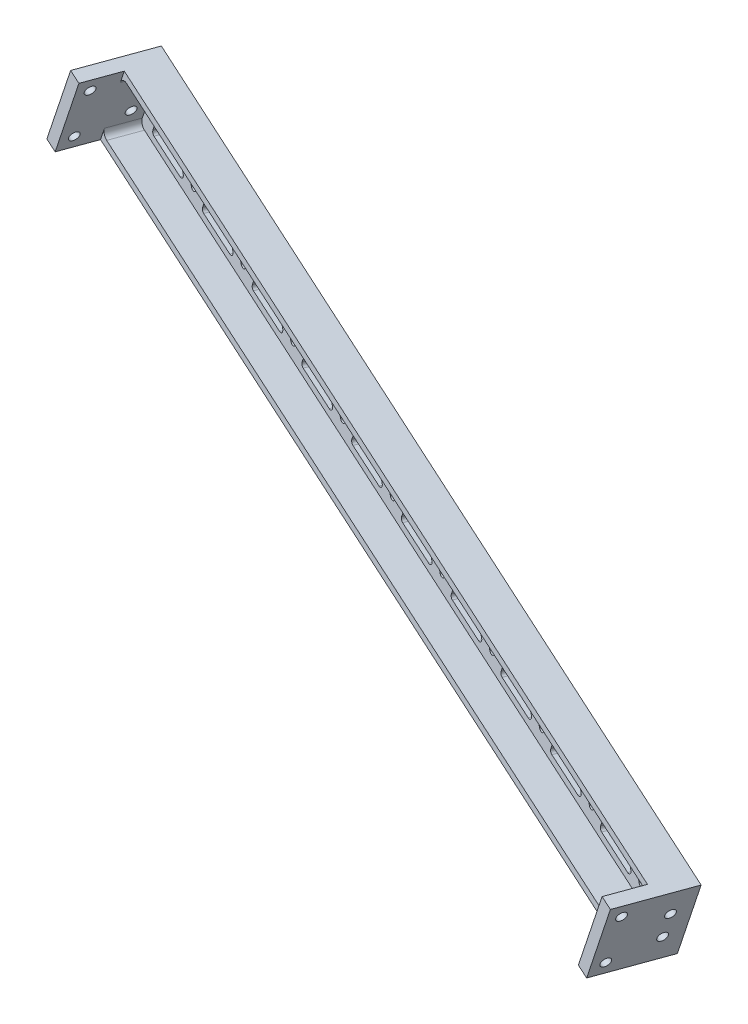
from build123d import *

# Parameters (mm, degrees)
SKETCH2_W                  = 38.1
SKETCH2_H                  = 38.1
BOSS_EXTRUDE1_DEPTH        = 6.35
BOSS_EXTRUDE2_DEPTH        = 407.126124618
SKETCH4_W                  = 38.1
SKETCH4_H                  = 38.1
BOSS_EXTRUDE3_DEPTH        = 6.35
FILLET1_R                  = 3.175
F_10_32_TAPPED_HOLE1_D     = 4.826
F_10_32_TAPPED_HOLE1_DEPTH = 6.35
F_10_32_TAPPED_HOLE2_D     = 4.826
CUT_EXTRUDE1_REACH         = 478.898


with BuildPart() as part:
    # Sketch2 → Boss-Extrude1 (new body)
    with BuildSketch(Plane(origin=(38.365770367, -12.788590122, 10.657158435), x_dir=(0.2417468892076139, -0.08058229640253844, -0.9669875568304563), z_dir=(0.917364944587726, -0.30578831486257557, 0.25482359571881275))):
        Rectangle(SKETCH2_W, SKETCH2_H)
    extrude(amount=BOSS_EXTRUDE1_DEPTH)

    # Sketch3 → Boss-Extrude2 (add)
    with BuildSketch(Plane(origin=(44.191037765, -14.730345922, 12.275288268), x_dir=(0.24174688920761397, -0.0805822964025384, -0.9669875568304563), z_dir=(0.917364944587726, -0.30578831486257557, 0.2548235957188128))):
        Polygon((0, 19.05), (0, 15.875), (15.875, 15.875), (15.875, -15.875), (0, -15.875), (0, -19.05), (19.05, -19.05), (19.05, 19.05), align=None)
    extrude(amount=BOSS_EXTRUDE2_DEPTH)

    # Sketch4 → Boss-Extrude3 (add)
    with BuildSketch(Plane(origin=(417.674272515, -139.224757505, 116.020631254), x_dir=(0.24174688920761386, -0.08058229640253753, -0.9669875568304566), z_dir=(0.9173649445877263, -0.30578831486257485, 0.2548235957188124))):
        Rectangle(SKETCH4_W, SKETCH4_H)
    extrude(amount=-BOSS_EXTRUDE3_DEPTH)

    # Fillet1
    fillet1_edges = [part.edges().sort_by_distance(p)[0] for p in [
        (41.089787913, -30.430315256, 4.599824536),
        (51.130019484, -0.309620543, 4.599824536),
        (408.747755265, -152.98297104, 106.727037689),
        (418.787986836, -122.862276327, 106.727037689),
    ]]
    fillet(fillet1_edges, radius=FILLET1_R)

    # #10-32 Tapped Hole1
    with Locations(Plane(origin=(38.365770367, -12.788590122, 10.657158435), x_dir=(-0.24174688920761406, 0.08058229640253843, 0.9669875568304563), z_dir=(-0.917364944587726, 0.3057883148625754, -0.25482359571881286))):
        with Locations((12.7, 12.7), (12.7, -12.7), (-9.525, -6.35), (-9.525, 6.35)):
            Hole(F_10_32_TAPPED_HOLE1_D / 2, depth=F_10_32_TAPPED_HOLE1_DEPTH)

    # #10-32 Tapped Hole2 (through all)
    with Locations(Plane(origin=(417.674272515, -139.224757505, 116.020631254), x_dir=(0.24174688920761347, -0.08058229640253826, -0.9669875568304566), z_dir=(0.9173649445877262, -0.30578831486257485, 0.25482359571881225))):
        with Locations((-12.7, 12.7), (-12.7, -12.7), (9.525, 6.35), (9.525, -6.35)):
            Hole(F_10_32_TAPPED_HOLE2_D / 2)

    # Sketch11 → Cut-Extrude1 (cut, up to next)
    with BuildSketch(Plane(origin=(3.837731866, -1.279243955, -15.350927465), x_dir=(0.9703393435074359, 0.02007598641739537, 0.24091183700874258), z_dir=(-0.24174688920761397, 0.08058229640253822, 0.9669875568304563)), mode=Mode.PRIVATE) as cut_extrude1_sk1:
        with BuildLine():
            Line((55.395545665, -9.716076146), (48.884204495, -28.605233817))
            ThreePointArc((48.884204495, -28.605233817), (48.957961721, -29.818012949), (49.867680304, -30.623423063))
            Line((49.867680304, -30.623423063), (68.756837975, -37.134764234))
            ThreePointArc((68.756837975, -37.134764234), (70.462799302, -36.686250733), (70.701269995, -34.938509292))
            Line((70.701269995, -34.938509292), (58.323453495, -9.538010451))
            ThreePointArc((58.323453495, -9.538010451), (56.800009733, -8.648860566), (55.395545665, -9.716076146))
        make_face()
    cut_extrude1_tool1 = extrude(cut_extrude1_sk1.sketch, amount=-CUT_EXTRUDE1_REACH, mode=Mode.PRIVATE) & part.part
    # Sketch11 → Cut-Extrude1 (cut, up to next)
    with BuildSketch(Plane(origin=(3.837731866, -1.279243955, -15.350927465), x_dir=(0.9703393435074359, 0.02007598641739537, 0.24091183700874258), z_dir=(-0.24174688920761397, 0.08058229640253822, 0.9669875568304563)), mode=Mode.PRIVATE) as cut_extrude1_sk2:
        with BuildLine():
            Line((79.632507934, -36.829870471), (86.143849105, -17.9407128))
            ThreePointArc((86.143849105, -17.9407128), (86.070091879, -16.727933668), (85.160373296, -15.922523554))
            Line((85.160373296, -15.922523554), (66.271215625, -9.411182383))
            ThreePointArc((66.271215625, -9.411182383), (64.565254297, -9.859695885), (64.326783605, -11.607437325))
            Line((64.326783605, -11.607437325), (76.704600105, -37.007936166))
            ThreePointArc((76.704600105, -37.007936166), (78.228043867, -37.897086051), (79.632507934, -36.829870471))
        make_face()
    cut_extrude1_tool2 = extrude(cut_extrude1_sk2.sketch, amount=-CUT_EXTRUDE1_REACH, mode=Mode.PRIVATE) & part.part
    # Sketch11 → Cut-Extrude1 (cut, up to next)
    with BuildSketch(Plane(origin=(3.837731866, -1.279243955, -15.350927465), x_dir=(0.9703393435074359, 0.02007598641739537, 0.24091183700874258), z_dir=(-0.24174688920761397, 0.08058229640253822, 0.9669875568304563)), mode=Mode.PRIVATE) as cut_extrude1_sk3:
        with BuildLine():
            Line((91.415526327, -22.132637389), (84.904185157, -41.02179506))
            ThreePointArc((84.904185157, -41.02179506), (84.977942383, -42.234574192), (85.887660966, -43.039984306))
            Line((85.887660966, -43.039984306), (104.776818637, -49.551325477))
            ThreePointArc((104.776818637, -49.551325477), (106.482779964, -49.102811976), (106.721250657, -47.355070536))
            Line((106.721250657, -47.355070536), (94.343434157, -21.954571694))
            ThreePointArc((94.343434157, -21.954571694), (92.819990395, -21.065421809), (91.415526327, -22.132637389))
        make_face()
    cut_extrude1_tool3 = extrude(cut_extrude1_sk3.sketch, amount=-CUT_EXTRUDE1_REACH, mode=Mode.PRIVATE) & part.part
    # Sketch11 → Cut-Extrude1 (cut, up to next)
    with BuildSketch(Plane(origin=(3.837731866, -1.279243955, -15.350927465), x_dir=(0.9703393435074359, 0.02007598641739537, 0.24091183700874258), z_dir=(-0.24174688920761397, 0.08058229640253822, 0.9669875568304563)), mode=Mode.PRIVATE) as cut_extrude1_sk4:
        with BuildLine():
            Line((115.652488596, -49.246431714), (122.163829767, -30.357274043))
            ThreePointArc((122.163829767, -30.357274043), (122.090072541, -29.144494911), (121.180353958, -28.339084797))
            Line((121.180353958, -28.339084797), (102.291196287, -21.827743627))
            ThreePointArc((102.291196287, -21.827743627), (100.585234959, -22.276257128), (100.346764267, -24.023998568))
            Line((100.346764267, -24.023998568), (112.724580767, -49.424497409))
            ThreePointArc((112.724580767, -49.424497409), (114.248024529, -50.313647294), (115.652488596, -49.246431714))
        make_face()
    cut_extrude1_tool4 = extrude(cut_extrude1_sk4.sketch, amount=-CUT_EXTRUDE1_REACH, mode=Mode.PRIVATE) & part.part
    # Sketch11 → Cut-Extrude1 (cut, up to next)
    with BuildSketch(Plane(origin=(3.837731866, -1.279243955, -15.350927465), x_dir=(0.9703393435074359, 0.02007598641739537, 0.24091183700874258), z_dir=(-0.24174688920761397, 0.08058229640253822, 0.9669875568304563)), mode=Mode.PRIVATE) as cut_extrude1_sk5:
        with BuildLine():
            Line((127.435506989, -34.549198632), (120.924165819, -53.438356303))
            ThreePointArc((120.924165819, -53.438356303), (120.997923045, -54.651135436), (121.907641628, -55.456545549))
            Line((121.907641628, -55.456545549), (140.796799299, -61.96788672))
            ThreePointArc((140.796799299, -61.96788672), (142.502760626, -61.519373219), (142.741231319, -59.771631779))
            Line((142.741231319, -59.771631779), (130.363414819, -34.371132937))
            ThreePointArc((130.363414819, -34.371132937), (128.839971057, -33.481983052), (127.435506989, -34.549198632))
        make_face()
    cut_extrude1_tool5 = extrude(cut_extrude1_sk5.sketch, amount=-CUT_EXTRUDE1_REACH, mode=Mode.PRIVATE) & part.part
    # Sketch11 → Cut-Extrude1 (cut, up to next)
    with BuildSketch(Plane(origin=(3.837731866, -1.279243955, -15.350927465), x_dir=(0.9703393435074359, 0.02007598641739537, 0.24091183700874258), z_dir=(-0.24174688920761397, 0.08058229640253822, 0.9669875568304563)), mode=Mode.PRIVATE) as cut_extrude1_sk6:
        with BuildLine():
            Line((151.672469258, -61.662992957), (158.183810429, -42.773835286))
            ThreePointArc((158.183810429, -42.773835286), (158.110053203, -41.561056154), (157.20033462, -40.75564604))
            Line((157.20033462, -40.75564604), (138.311176949, -34.24430487))
            ThreePointArc((138.311176949, -34.24430487), (136.605215621, -34.692818371), (136.366744929, -36.440559811))
            Line((136.366744929, -36.440559811), (148.744561429, -61.841058653))
            ThreePointArc((148.744561429, -61.841058653), (150.268005191, -62.730208537), (151.672469258, -61.662992957))
        make_face()
    cut_extrude1_tool6 = extrude(cut_extrude1_sk6.sketch, amount=-CUT_EXTRUDE1_REACH, mode=Mode.PRIVATE) & part.part
    # Sketch11 → Cut-Extrude1 (cut, up to next)
    with BuildSketch(Plane(origin=(3.837731866, -1.279243955, -15.350927465), x_dir=(0.9703393435074359, 0.02007598641739537, 0.24091183700874258), z_dir=(-0.24174688920761397, 0.08058229640253822, 0.9669875568304563)), mode=Mode.PRIVATE) as cut_extrude1_sk7:
        with BuildLine():
            Line((163.455487652, -46.965759876), (156.944146481, -65.854917546))
            ThreePointArc((156.944146481, -65.854917546), (157.017903707, -67.067696679), (157.92762229, -67.873106792))
            Line((157.92762229, -67.873106792), (176.816779961, -74.384447963))
            ThreePointArc((176.816779961, -74.384447963), (178.522741289, -73.935934462), (178.761211981, -72.188193022))
            Line((178.761211981, -72.188193022), (166.383395481, -46.78769418))
            ThreePointArc((166.383395481, -46.78769418), (164.859951719, -45.898544295), (163.455487652, -46.965759876))
        make_face()
    cut_extrude1_tool7 = extrude(cut_extrude1_sk7.sketch, amount=-CUT_EXTRUDE1_REACH, mode=Mode.PRIVATE) & part.part
    # Sketch11 → Cut-Extrude1 (cut, up to next)
    with BuildSketch(Plane(origin=(3.837731866, -1.279243955, -15.350927465), x_dir=(0.9703393435074359, 0.02007598641739537, 0.24091183700874258), z_dir=(-0.24174688920761397, 0.08058229640253822, 0.9669875568304563)), mode=Mode.PRIVATE) as cut_extrude1_sk8:
        with BuildLine():
            Line((187.69244992, -74.0795542), (194.203791091, -55.190396529))
            ThreePointArc((194.203791091, -55.190396529), (194.130033865, -53.977617397), (193.220315282, -53.172207283))
            Line((193.220315282, -53.172207283), (174.331157611, -46.660866113))
            ThreePointArc((174.331157611, -46.660866113), (172.625196284, -47.109379614), (172.386725591, -48.857121054))
            Line((172.386725591, -48.857121054), (184.764542091, -74.257619896))
            ThreePointArc((184.764542091, -74.257619896), (186.287985853, -75.146769781), (187.69244992, -74.0795542))
        make_face()
    cut_extrude1_tool8 = extrude(cut_extrude1_sk8.sketch, amount=-CUT_EXTRUDE1_REACH, mode=Mode.PRIVATE) & part.part
    # Sketch11 → Cut-Extrude1 (cut, up to next)
    with BuildSketch(Plane(origin=(3.837731866, -1.279243955, -15.350927465), x_dir=(0.9703393435074359, 0.02007598641739537, 0.24091183700874258), z_dir=(-0.24174688920761397, 0.08058229640253822, 0.9669875568304563)), mode=Mode.PRIVATE) as cut_extrude1_sk9:
        with BuildLine():
            Line((199.475468314, -59.382321119), (192.964127143, -78.27147879))
            ThreePointArc((192.964127143, -78.27147879), (193.037884369, -79.484257922), (193.947602952, -80.289668036))
            Line((193.947602952, -80.289668036), (212.836760623, -86.801009206))
            ThreePointArc((212.836760623, -86.801009206), (214.542721951, -86.352495705), (214.781192643, -84.604754265))
            Line((214.781192643, -84.604754265), (202.403376143, -59.204255423))
            ThreePointArc((202.403376143, -59.204255423), (200.879932381, -58.315105538), (199.475468314, -59.382321119))
        make_face()
    cut_extrude1_tool9 = extrude(cut_extrude1_sk9.sketch, amount=-CUT_EXTRUDE1_REACH, mode=Mode.PRIVATE) & part.part
    # Sketch11 → Cut-Extrude1 (cut, up to next)
    with BuildSketch(Plane(origin=(3.837731866, -1.279243955, -15.350927465), x_dir=(0.9703393435074359, 0.02007598641739537, 0.24091183700874258), z_dir=(-0.24174688920761397, 0.08058229640253822, 0.9669875568304563)), mode=Mode.PRIVATE) as cut_extrude1_sk10:
        with BuildLine():
            Line((223.712430583, -86.496115443), (230.223771753, -67.606957773))
            ThreePointArc((230.223771753, -67.606957773), (230.150014527, -66.39417864), (229.240295944, -65.588768527))
            Line((229.240295944, -65.588768527), (210.351138273, -59.077427356))
            ThreePointArc((210.351138273, -59.077427356), (208.645176946, -59.525940857), (208.406706253, -61.273682297))
            Line((208.406706253, -61.273682297), (220.784522753, -86.674181139))
            ThreePointArc((220.784522753, -86.674181139), (222.307966515, -87.563331024), (223.712430583, -86.496115443))
        make_face()
    cut_extrude1_tool10 = extrude(cut_extrude1_sk10.sketch, amount=-CUT_EXTRUDE1_REACH, mode=Mode.PRIVATE) & part.part
    # Sketch11 → Cut-Extrude1 (cut, up to next)
    with BuildSketch(Plane(origin=(3.837731866, -1.279243955, -15.350927465), x_dir=(0.9703393435074359, 0.02007598641739537, 0.24091183700874258), z_dir=(-0.24174688920761397, 0.08058229640253822, 0.9669875568304563)), mode=Mode.PRIVATE) as cut_extrude1_sk11:
        with BuildLine():
            Line((235.495448976, -71.798882362), (228.984107805, -90.688040033))
            ThreePointArc((228.984107805, -90.688040033), (229.057865031, -91.900819165), (229.967583614, -92.706229279))
            Line((229.967583614, -92.706229279), (248.856741285, -99.217570449))
            ThreePointArc((248.856741285, -99.217570449), (250.562702613, -98.769056948), (250.801173305, -97.021315508))
            Line((250.801173305, -97.021315508), (238.423356805, -71.620816666))
            ThreePointArc((238.423356805, -71.620816666), (236.899913043, -70.731666781), (235.495448976, -71.798882362))
        make_face()
    cut_extrude1_tool11 = extrude(cut_extrude1_sk11.sketch, amount=-CUT_EXTRUDE1_REACH, mode=Mode.PRIVATE) & part.part
    # Sketch11 → Cut-Extrude1 (cut, up to next)
    with BuildSketch(Plane(origin=(3.837731866, -1.279243955, -15.350927465), x_dir=(0.9703393435074359, 0.02007598641739537, 0.24091183700874258), z_dir=(-0.24174688920761397, 0.08058229640253822, 0.9669875568304563)), mode=Mode.PRIVATE) as cut_extrude1_sk12:
        with BuildLine():
            Line((259.732411245, -98.912676686), (266.243752415, -80.023519016))
            ThreePointArc((266.243752415, -80.023519016), (266.169995189, -78.810739883), (265.260276606, -78.00532977))
            Line((265.260276606, -78.00532977), (246.371118935, -71.493988599))
            ThreePointArc((246.371118935, -71.493988599), (244.665157608, -71.9425021), (244.426686915, -73.69024354))
            Line((244.426686915, -73.69024354), (256.804503415, -99.090742382))
            ThreePointArc((256.804503415, -99.090742382), (258.327947177, -99.979892267), (259.732411245, -98.912676686))
        make_face()
    cut_extrude1_tool12 = extrude(cut_extrude1_sk12.sketch, amount=-CUT_EXTRUDE1_REACH, mode=Mode.PRIVATE) & part.part
    # Sketch11 → Cut-Extrude1 (cut, up to next)
    with BuildSketch(Plane(origin=(3.837731866, -1.279243955, -15.350927465), x_dir=(0.9703393435074359, 0.02007598641739537, 0.24091183700874258), z_dir=(-0.24174688920761397, 0.08058229640253822, 0.9669875568304563)), mode=Mode.PRIVATE) as cut_extrude1_sk13:
        with BuildLine():
            Line((271.515429638, -84.215443605), (265.004088467, -103.104601276))
            ThreePointArc((265.004088467, -103.104601276), (265.077845693, -104.317380408), (265.987564276, -105.122790522))
            Line((265.987564276, -105.122790522), (284.876721947, -111.634131692))
            ThreePointArc((284.876721947, -111.634131692), (286.582683275, -111.185618191), (286.821153967, -109.437876751))
            Line((286.821153967, -109.437876751), (274.443337467, -84.03737791))
            ThreePointArc((274.443337467, -84.03737791), (272.919893706, -83.148228025), (271.515429638, -84.215443605))
        make_face()
    cut_extrude1_tool13 = extrude(cut_extrude1_sk13.sketch, amount=-CUT_EXTRUDE1_REACH, mode=Mode.PRIVATE) & part.part
    # Sketch11 → Cut-Extrude1 (cut, up to next)
    with BuildSketch(Plane(origin=(3.837731866, -1.279243955, -15.350927465), x_dir=(0.9703393435074359, 0.02007598641739537, 0.24091183700874258), z_dir=(-0.24174688920761397, 0.08058229640253822, 0.9669875568304563)), mode=Mode.PRIVATE) as cut_extrude1_sk14:
        with BuildLine():
            Line((295.752391907, -111.32923793), (302.263733077, -92.440080259))
            ThreePointArc((302.263733077, -92.440080259), (302.189975851, -91.227301127), (301.280257268, -90.421891013))
            Line((301.280257268, -90.421891013), (282.391099597, -83.910549842))
            ThreePointArc((282.391099597, -83.910549842), (280.68513827, -84.359063343), (280.446667577, -86.106804783))
            Line((280.446667577, -86.106804783), (292.824484078, -111.507303625))
            ThreePointArc((292.824484078, -111.507303625), (294.347927839, -112.39645351), (295.752391907, -111.32923793))
        make_face()
    cut_extrude1_tool14 = extrude(cut_extrude1_sk14.sketch, amount=-CUT_EXTRUDE1_REACH, mode=Mode.PRIVATE) & part.part
    # Sketch11 → Cut-Extrude1 (cut, up to next)
    with BuildSketch(Plane(origin=(3.837731866, -1.279243955, -15.350927465), x_dir=(0.9703393435074359, 0.02007598641739537, 0.24091183700874258), z_dir=(-0.24174688920761397, 0.08058229640253822, 0.9669875568304563)), mode=Mode.PRIVATE) as cut_extrude1_sk15:
        with BuildLine():
            Line((307.5354103, -96.632004848), (301.024069129, -115.521162519))
            ThreePointArc((301.024069129, -115.521162519), (301.097826355, -116.733941651), (302.007544938, -117.539351765))
            Line((302.007544938, -117.539351765), (320.896702609, -124.050692935))
            ThreePointArc((320.896702609, -124.050692935), (322.602663937, -123.602179434), (322.841134629, -121.854437994))
            Line((322.841134629, -121.854437994), (310.463318129, -96.453939153))
            ThreePointArc((310.463318129, -96.453939153), (308.939874368, -95.564789268), (307.5354103, -96.632004848))
        make_face()
    cut_extrude1_tool15 = extrude(cut_extrude1_sk15.sketch, amount=-CUT_EXTRUDE1_REACH, mode=Mode.PRIVATE) & part.part
    # Sketch11 → Cut-Extrude1 (cut, up to next)
    with BuildSketch(Plane(origin=(3.837731866, -1.279243955, -15.350927465), x_dir=(0.9703393435074359, 0.02007598641739537, 0.24091183700874258), z_dir=(-0.24174688920761397, 0.08058229640253822, 0.9669875568304563)), mode=Mode.PRIVATE) as cut_extrude1_sk16:
        with BuildLine():
            Line((331.772372569, -123.745799173), (338.283713739, -104.856641502))
            ThreePointArc((338.283713739, -104.856641502), (338.209956513, -103.64386237), (337.30023793, -102.838452256))
            Line((337.30023793, -102.838452256), (318.411080259, -96.327111085))
            ThreePointArc((318.411080259, -96.327111085), (316.705118932, -96.775624586), (316.466648239, -98.523366026))
            Line((316.466648239, -98.523366026), (328.84446474, -123.923864868))
            ThreePointArc((328.84446474, -123.923864868), (330.367908501, -124.813014753), (331.772372569, -123.745799173))
        make_face()
    cut_extrude1_tool16 = extrude(cut_extrude1_sk16.sketch, amount=-CUT_EXTRUDE1_REACH, mode=Mode.PRIVATE) & part.part
    # Sketch11 → Cut-Extrude1 (cut, up to next)
    with BuildSketch(Plane(origin=(3.837731866, -1.279243955, -15.350927465), x_dir=(0.9703393435074359, 0.02007598641739537, 0.24091183700874258), z_dir=(-0.24174688920761397, 0.08058229640253822, 0.9669875568304563)), mode=Mode.PRIVATE) as cut_extrude1_sk17:
        with BuildLine():
            Line((343.555390962, -109.048566091), (337.044049791, -127.937723762))
            ThreePointArc((337.044049791, -127.937723762), (337.117807017, -129.150502894), (338.0275256, -129.955913008))
            Line((338.0275256, -129.955913008), (356.916683271, -136.467254179))
            ThreePointArc((356.916683271, -136.467254179), (358.622644599, -136.018740677), (358.861115291, -134.270999237))
            Line((358.861115291, -134.270999237), (346.483298791, -108.870500396))
            ThreePointArc((346.483298791, -108.870500396), (344.95985503, -107.981350511), (343.555390962, -109.048566091))
        make_face()
    cut_extrude1_tool17 = extrude(cut_extrude1_sk17.sketch, amount=-CUT_EXTRUDE1_REACH, mode=Mode.PRIVATE) & part.part
    # Sketch11 → Cut-Extrude1 (cut, up to next)
    with BuildSketch(Plane(origin=(3.837731866, -1.279243955, -15.350927465), x_dir=(0.9703393435074359, 0.02007598641739537, 0.24091183700874258), z_dir=(-0.24174688920761397, 0.08058229640253822, 0.9669875568304563)), mode=Mode.PRIVATE) as cut_extrude1_sk18:
        with BuildLine():
            Line((367.792353231, -136.162360416), (374.303694402, -117.273202745))
            ThreePointArc((374.303694402, -117.273202745), (374.229937176, -116.060423613), (373.320218592, -115.255013499))
            Line((373.320218592, -115.255013499), (354.431060922, -108.743672328))
            ThreePointArc((354.431060922, -108.743672328), (352.725099594, -109.19218583), (352.486628901, -110.93992727))
            Line((352.486628901, -110.93992727), (364.864445402, -136.340426111))
            ThreePointArc((364.864445402, -136.340426111), (366.387889163, -137.229575996), (367.792353231, -136.162360416))
        make_face()
    cut_extrude1_tool18 = extrude(cut_extrude1_sk18.sketch, amount=-CUT_EXTRUDE1_REACH, mode=Mode.PRIVATE) & part.part
    # Sketch11 → Cut-Extrude1 (cut, up to next)
    with BuildSketch(Plane(origin=(3.837731866, -1.279243955, -15.350927465), x_dir=(0.9703393435074359, 0.02007598641739537, 0.24091183700874258), z_dir=(-0.24174688920761397, 0.08058229640253822, 0.9669875568304563)), mode=Mode.PRIVATE) as cut_extrude1_sk19:
        with BuildLine():
            Line((379.575371624, -121.465127334), (373.064030453, -140.354285005))
            ThreePointArc((373.064030453, -140.354285005), (373.137787679, -141.567064137), (374.047506263, -142.372474251))
            Line((374.047506263, -142.372474251), (392.936663933, -148.883815422))
            ThreePointArc((392.936663933, -148.883815422), (394.642625261, -148.43530192), (394.881095953, -146.68756048))
            Line((394.881095953, -146.68756048), (382.503279453, -121.287061639))
            ThreePointArc((382.503279453, -121.287061639), (380.979835692, -120.397911754), (379.575371624, -121.465127334))
        make_face()
    cut_extrude1_tool19 = extrude(cut_extrude1_sk19.sketch, amount=-CUT_EXTRUDE1_REACH, mode=Mode.PRIVATE) & part.part
    # Sketch11 → Cut-Extrude1 (cut, up to next)
    with BuildSketch(Plane(origin=(3.837731866, -1.279243955, -15.350927465), x_dir=(0.9703393435074359, 0.02007598641739537, 0.24091183700874258), z_dir=(-0.24174688920761397, 0.08058229640253822, 0.9669875568304563)), mode=Mode.PRIVATE) as cut_extrude1_sk20:
        with BuildLine():
            Line((403.812333893, -148.578921659), (410.323675064, -129.689763988))
            ThreePointArc((410.323675064, -129.689763988), (410.249917838, -128.476984856), (409.340199254, -127.671574742))
            Line((409.340199254, -127.671574742), (390.451041584, -121.160233571))
            ThreePointArc((390.451041584, -121.160233571), (388.745080256, -121.608747073), (388.506609564, -123.356488513))
            Line((388.506609564, -123.356488513), (400.884426064, -148.756987354))
            ThreePointArc((400.884426064, -148.756987354), (402.407869825, -149.646137239), (403.812333893, -148.578921659))
        make_face()
    cut_extrude1_tool20 = extrude(cut_extrude1_sk20.sketch, amount=-CUT_EXTRUDE1_REACH, mode=Mode.PRIVATE) & part.part
    add(cut_extrude1_tool1.solids().sort_by_distance((61.140655, -24.905563, 0.943663))[0], mode=Mode.SUBTRACT)
    add(cut_extrude1_tool2.solids().sort_by_distance((77.557842, -21.32727, 4.749769))[0], mode=Mode.SUBTRACT)
    add(cut_extrude1_tool3.solids().sort_by_distance((96.092259, -36.556097, 10.652442))[0], mode=Mode.SUBTRACT)
    add(cut_extrude1_tool4.solids().sort_by_distance((112.509446, -32.977804, 14.458548))[0], mode=Mode.SUBTRACT)
    add(cut_extrude1_tool5.solids().sort_by_distance((131.043864, -48.206632, 20.361221))[0], mode=Mode.SUBTRACT)
    add(cut_extrude1_tool6.solids().sort_by_distance((147.46105, -44.628339, 24.167327))[0], mode=Mode.SUBTRACT)
    add(cut_extrude1_tool7.solids().sort_by_distance((165.995468, -59.857167, 30.07))[0], mode=Mode.SUBTRACT)
    add(cut_extrude1_tool8.solids().sort_by_distance((182.412655, -56.278874, 33.876106))[0], mode=Mode.SUBTRACT)
    add(cut_extrude1_tool9.solids().sort_by_distance((200.947073, -71.507702, 39.778779))[0], mode=Mode.SUBTRACT)
    add(cut_extrude1_tool10.solids().sort_by_distance((217.364259, -67.929409, 43.584885))[0], mode=Mode.SUBTRACT)
    add(cut_extrude1_tool11.solids().sort_by_distance((235.898677, -83.158237, 49.487558))[0], mode=Mode.SUBTRACT)
    add(cut_extrude1_tool12.solids().sort_by_distance((252.315864, -79.579944, 53.293664))[0], mode=Mode.SUBTRACT)
    add(cut_extrude1_tool13.solids().sort_by_distance((270.850281, -94.808771, 59.196337))[0], mode=Mode.SUBTRACT)
    add(cut_extrude1_tool14.solids().sort_by_distance((287.267468, -91.230478, 63.002443))[0], mode=Mode.SUBTRACT)
    add(cut_extrude1_tool15.solids().sort_by_distance((305.801886, -106.459306, 68.905116))[0], mode=Mode.SUBTRACT)
    add(cut_extrude1_tool16.solids().sort_by_distance((322.219072, -102.881013, 72.711222))[0], mode=Mode.SUBTRACT)
    add(cut_extrude1_tool17.solids().sort_by_distance((340.75349, -118.109841, 78.613895))[0], mode=Mode.SUBTRACT)
    add(cut_extrude1_tool18.solids().sort_by_distance((357.170677, -114.531548, 82.420001))[0], mode=Mode.SUBTRACT)
    add(cut_extrude1_tool19.solids().sort_by_distance((375.705094, -129.760376, 88.322674))[0], mode=Mode.SUBTRACT)
    add(cut_extrude1_tool20.solids().sort_by_distance((392.122281, -126.182083, 92.12878))[0], mode=Mode.SUBTRACT)


solid = part.part
